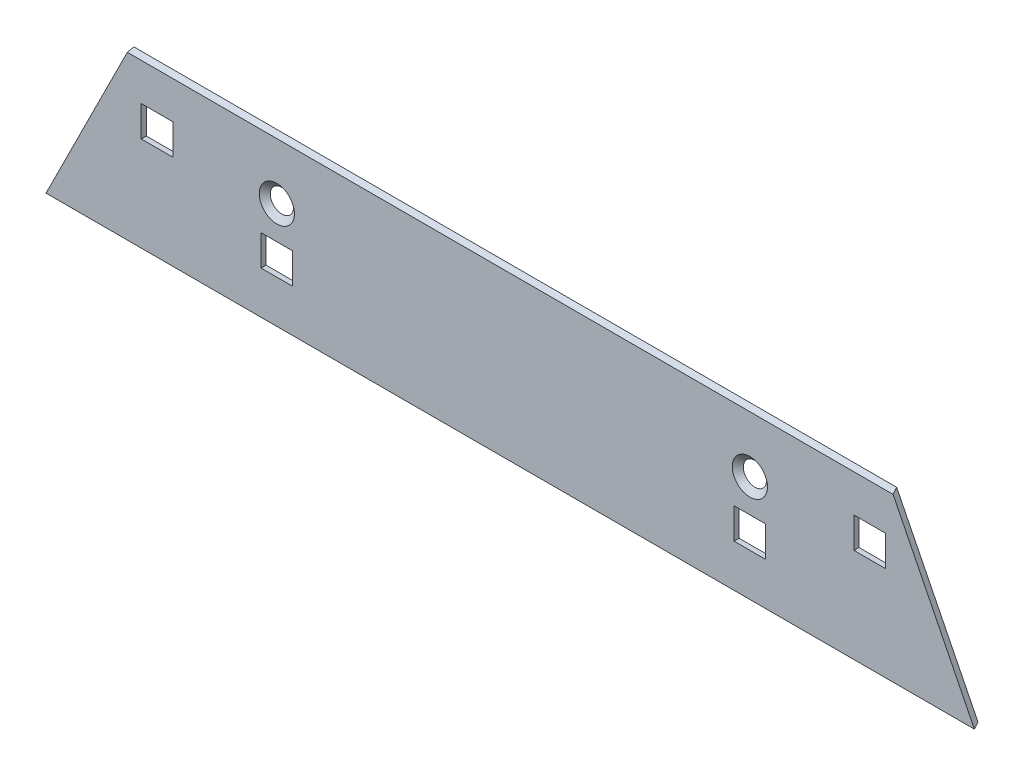
from build123d import *

# Parameters (mm, degrees)
BOSS_EXTRUDE2_DEPTH                       = 186.944
CUT_EXTRUDE1_DEPTH                        = 190.568748947
SKETCH6_W                                 = 6.35
SKETCH6_H                                 = 6.1722
CUT_EXTRUDE3_DEPTH                        = 190.568748947
CSK_FOR_6_FLAT_HEAD_MACHINE_SCREW_2_COUNT = 2
CSK_FOR_6_FLAT_HEAD_MACHINE_SCREW_2_PITCH = 95.25


with BuildPart() as part:
    # Sketch3 → Boss-Extrude2 (new body)
    with BuildSketch(Plane(origin=(0, 0, 0), x_dir=(0, 0, -1), z_dir=(1, 0, 0))):
        Polygon((-0.5715, 31.420044321), (-1.5875, 30.833456448), (-1.5875, -1.917455679), (-0.5715, -1.330867805), align=None)
    extrude(amount=BOSS_EXTRUDE2_DEPTH)

    # Sketch5 → Cut-Extrude1 (cut, through all)
    with BuildSketch(Plane.XY.offset(1.5875)):
        Polygon((0, -1.917455679), (16.672349491, 31.420044321), (0, 31.420044321), align=None)
        Polygon((186.944, -1.917455679), (186.944, 31.420044321), (170.271650509, 31.420044321), align=None)
    extrude(amount=-CUT_EXTRUDE1_DEPTH, mode=Mode.SUBTRACT)

    # Sketch6 → Cut-Extrude3 (cut, through all)
    with BuildSketch(Plane.XY.offset(1.5875)):
        with Locations((22.352, 20.210554054)):
            Rectangle(SKETCH6_W, SKETCH6_H)
        with Locations((46.482, 9.753360379)):
            Rectangle(SKETCH6_W, SKETCH6_H)
        with Locations((141.732, 9.753360379)):
            Rectangle(SKETCH6_W, SKETCH6_H)
        with Locations((165.862, 20.210554054)):
            Rectangle(SKETCH6_W, SKETCH6_H)
    extrude(amount=-CUT_EXTRUDE3_DEPTH, mode=Mode.SUBTRACT)

    # Sketch7 → CSK for #6 Flat Head Machine Screw (100)1 (revolve, cut)
    with BuildSketch(Plane(origin=(46.482, 19.486654054, 1.5875), x_dir=(0, -1, 0), z_dir=(1, 0, 0))):
        Polygon((0, 0), (0, 1.016), (1.89865, 1.016), (1.89865, 1.380025208), (3.5433, 0), align=None)
    csk_for_6_flat_head_machine_screw_100 = revolve(axis=Axis((46.482, 19.486654054, 7.9375), (0, 0, -1)), mode=Mode.SUBTRACT)

    # CSK for _6 Flat Head Machine Screw _ 2: CSK for #6 Flat Head Machine Screw (100)1 ×2
    with Locations(*[(i * CSK_FOR_6_FLAT_HEAD_MACHINE_SCREW_2_PITCH, 0, 0) for i in range(1, CSK_FOR_6_FLAT_HEAD_MACHINE_SCREW_2_COUNT)]):
        add(csk_for_6_flat_head_machine_screw_100, mode=Mode.SUBTRACT)


solid = part.part
